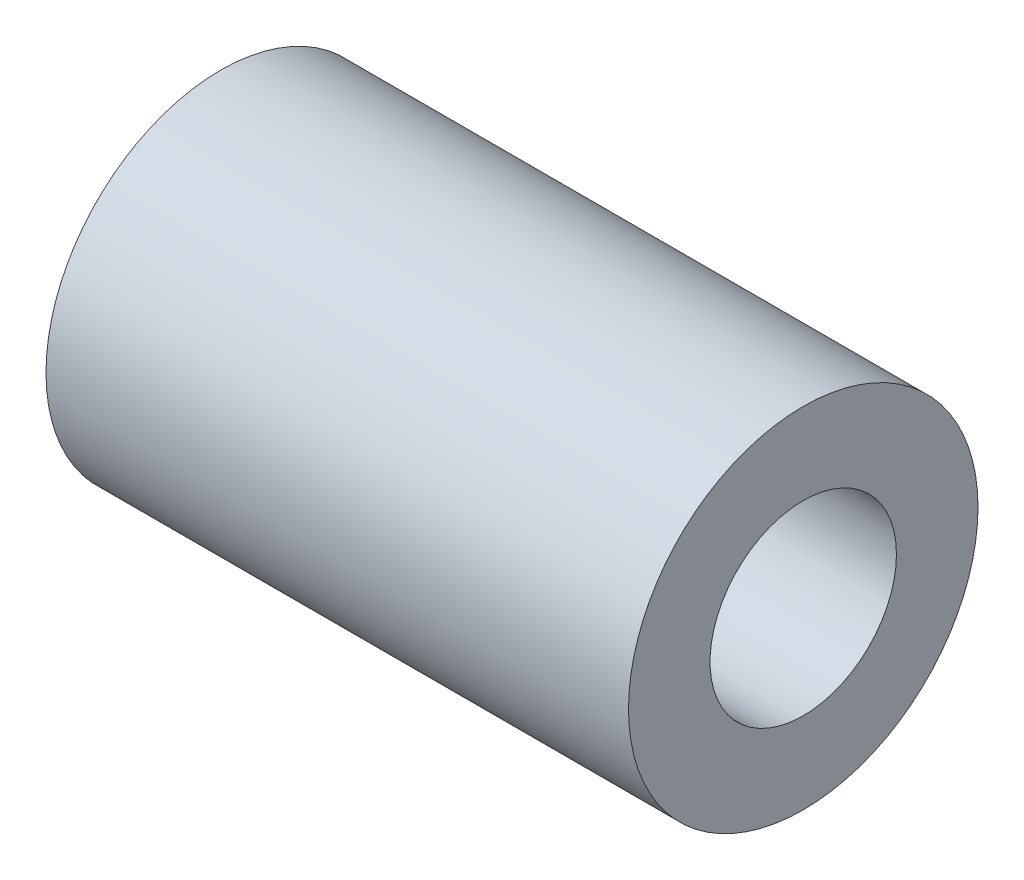
from build123d import *

# Parameters (mm, degrees)
SKETCH_1_R          = 7.5
EXTRUDE_1_DEPTH     = 25
SKETCH_2_R          = 2.5
CUT_EXTRUDE_1_DEPTH = 12.5
SKETCH_3_R          = 4
CUT_EXTRUDE_2_DEPTH = 12.5


with BuildPart() as part:
    # 草图1 → 凸台-拉伸1 (new body)
    with BuildSketch(Plane(origin=(0, 0, 0), x_dir=(0, 0, -1), z_dir=(1, 0, 0))):
        Circle(SKETCH_1_R)
    extrude(amount=EXTRUDE_1_DEPTH)

    # 草图2 → 切除-拉伸1 (cut)
    with BuildSketch(Plane.ZY):
        Circle(SKETCH_2_R)
    extrude(amount=-CUT_EXTRUDE_1_DEPTH, mode=Mode.SUBTRACT)

    # 草图3 → 切除-拉伸2 (cut)
    with BuildSketch(Plane(origin=(25, 0, 0), x_dir=(0, 0, -1), z_dir=(1, 0, 0))):
        Circle(SKETCH_3_R)
    extrude(amount=-CUT_EXTRUDE_2_DEPTH, mode=Mode.SUBTRACT)


solid = part.part
